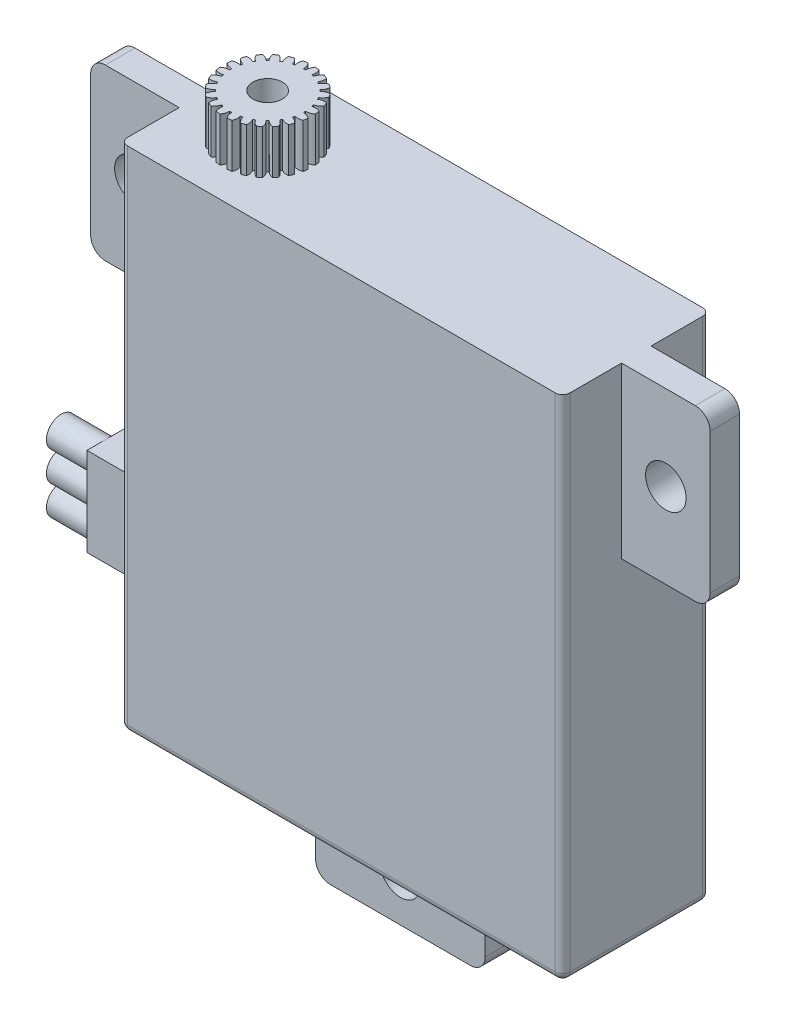
from build123d import *

# Parameters (mm, degrees)
SKETCH1_W             = 30
SKETCH1_H             = 34.5
BOSS_EXTRUDE1_DEPTH   = 10
SKETCH2_W             = 2
SKETCH2_H             = 11.5
BOSS_EXTRUDE4_DEPTH   = 21
SKETCH3_W             = 11.5
SKETCH3_H             = 2
BOSS_EXTRUDE5_DEPTH   = 6
FILLET2_R             = 1
SKETCH4_R             = 1.375
CUT_EXTRUDE1_DEPTH    = 10
FILLET3_R             = 0.5
SKETCH5_W             = 2.5
SKETCH5_H             = 6
CUT_EXTRUDE2_DEPTH    = 1
SKETCH6_R             = 3
SKETCH6_R_2           = 1
BOSS_EXTRUDE6_DEPTH   = 3
CUT_EXTRUDE3_START    = -3
CUT_EXTRUDE3_DEPTH    = 3
CIRPATTERN1_COUNT     = 24
SKETCH8_W             = 2.5
SKETCH8_H             = 6
BOSS_EXTRUDE7_DEPTH   = 7
SKETCH9_R             = 1
BOSS_EXTRUDE8_DEPTH   = 3
BOSS_EXTRUDE8_2_DEPTH = 3
BOSS_EXTRUDE8_3_DEPTH = 3


with BuildPart() as part:
    # Sketch1 → Boss-Extrude1 (new body)
    with BuildSketch(Plane.XY):
        with Locations((0.31359995, -1.512440758)):
            Rectangle(SKETCH1_W, SKETCH1_H)
    extrude(amount=BOSS_EXTRUDE1_DEPTH)

    # Sketch2 → Boss-Extrude4 (add, symmetric)
    with BuildSketch(Plane(origin=(0.31359995, 0, 0), x_dir=(0, 0, -1), z_dir=(1, 0, 0))):
        with Locations((-5, 9.987559242)):
            Rectangle(SKETCH2_W, SKETCH2_H)
    extrude(amount=BOSS_EXTRUDE4_DEPTH, both=True)

    # Sketch3 → Boss-Extrude5 (add)
    with BuildSketch(Plane.XZ.offset(18.762440758)):
        with Locations((0.31359995, 5)):
            Rectangle(SKETCH3_W, SKETCH3_H)
    extrude(amount=BOSS_EXTRUDE5_DEPTH)

    # Fillet2
    fillet2_edges = [part.edges().sort_by_distance(p)[0] for p in [
        (21.31359995, 15.737559242, 5),
        (-20.68640005, 4.237559242, 5),
        (21.31359995, 4.237559242, 5),
        (-20.68640005, 15.737559242, 5),
        (-5.43640005, -24.762440758, 5),
        (6.06359995, -24.762440758, 5),
    ]]
    fillet(fillet2_edges, radius=FILLET2_R)

    # Sketch4 → Cut-Extrude1 (cut)
    with BuildSketch(Plane.XY.offset(10)):
        with Locations((-17.68640005, 9.987559242)):
            Circle(SKETCH4_R)
        with Locations((18.31359995, 9.987559242)):
            Circle(SKETCH4_R)
        with Locations((0.31359995, -21.762440758)):
            Circle(SKETCH4_R)
    extrude(amount=-CUT_EXTRUDE1_DEPTH, mode=Mode.SUBTRACT)

    # Fillet3
    fillet3_edges = [part.edges().sort_by_distance(p)[0] for p in [
        (15.31359995, -1.512440758, 10),
        (-14.68640005, -1.512440758, 10),
        (15.31359995, -1.512440758, 0),
        (0.31359995, -18.762440758, 0),
        (-14.68640005, -1.512440758, 0),
        (15.31359995, -18.762440758, 5),
        (-14.68640005, -18.762440758, 5),
        (0.31359995, -18.762440758, 10),
    ]]
    fillet(fillet3_edges, radius=FILLET3_R)

    # Sketch5 → Cut-Extrude2 (cut)
    with BuildSketch(Plane.ZY.offset(14.68640005)):
        with Locations((5, -10.262440758)):
            Rectangle(SKETCH5_W, SKETCH5_H)
    extrude(amount=-CUT_EXTRUDE2_DEPTH, mode=Mode.SUBTRACT)

    # Sketch6 → Boss-Extrude6 (add)
    with BuildSketch(Plane(origin=(0, 15.737559242, 0), x_dir=(1, 0, 0), z_dir=(0, 1, 0))):
        with Locations(Location((-9.68640005, -5, 0), (0, 0, 90))):
            Circle(SKETCH6_R)
        with Locations(Location((-9.68640005, -5, 0), (0, 0, 270))):
            Circle(SKETCH6_R_2, mode=Mode.SUBTRACT)
    extrude(amount=BOSS_EXTRUDE6_DEPTH)

    # Sketch7 → Cut-Extrude3 (cut)
    with BuildSketch(Plane(origin=(0, 18.737559242, 0), x_dir=(1, 0, 0), z_dir=(0, 1, 0)).offset(CUT_EXTRUDE3_START)):
        with BuildLine():
            Line((-9.68640005, -2), (-9.68640005, -2.5))
            Line((-9.68640005, -2.5), (-9.61140005, -2.5))
            ThreePointArc((-9.61140005, -2.5), (-9.571129509, -2.240512735), (-9.446003633, -2.009647251))
            ThreePointArc((-9.446003633, -2.009647251), (-9.566105093, -2.002412783), (-9.68640005, -2))
        make_face()
        with BuildLine():
            Line((-9.76140005, -2.5), (-9.68640005, -2.5))
            Line((-9.68640005, -2.5), (-9.68640005, -2))
            ThreePointArc((-9.68640005, -2), (-9.806695006, -2.002412783), (-9.926796466, -2.009647251))
            ThreePointArc((-9.926796466, -2.009647251), (-9.80167059, -2.240512735), (-9.76140005, -2.5))
        make_face()
    cut_extrude3 = extrude(amount=CUT_EXTRUDE3_DEPTH, mode=Mode.SUBTRACT)

    # CirPattern1: Cut-Extrude3 ×24 about axis
    cirpattern1_axis = Axis((-9.68640005, 0, 5), (0, 1, 0))
    for i in range(1, CIRPATTERN1_COUNT):
        add(cut_extrude3.rotate(cirpattern1_axis, i * 360 / CIRPATTERN1_COUNT), mode=Mode.SUBTRACT)


with BuildPart() as body_2:
    # Sketch8 → Boss-Extrude7 (new body)
    with BuildSketch(Plane.ZY.offset(13.68640005)):
        with Locations((5, -10.262440758)):
            Rectangle(SKETCH8_W, SKETCH8_H)
    extrude(amount=BOSS_EXTRUDE7_DEPTH)


with BuildPart() as body_3:
    # Sketch9 → Boss-Extrude8 (new body)
    with BuildSketch(Plane.ZY.offset(20.68640005)):
        with Locations((5, -8.262440758)):
            Circle(SKETCH9_R)
    extrude(amount=BOSS_EXTRUDE8_DEPTH)


with BuildPart() as body_4:
    # Sketch9 → Boss-Extrude8 2 (new body)
    with BuildSketch(Plane.ZY.offset(20.68640005)):
        with Locations((5, -10.262440758)):
            Circle(SKETCH9_R)
    extrude(amount=BOSS_EXTRUDE8_2_DEPTH)


with BuildPart() as body_5:
    # Sketch9 → Boss-Extrude8 3 (new body)
    with BuildSketch(Plane.ZY.offset(20.68640005)):
        with Locations((5, -12.262440758)):
            Circle(SKETCH9_R)
    extrude(amount=BOSS_EXTRUDE8_3_DEPTH)


solid = Compound([part.part, body_2.part, body_3.part, body_4.part, body_5.part])
